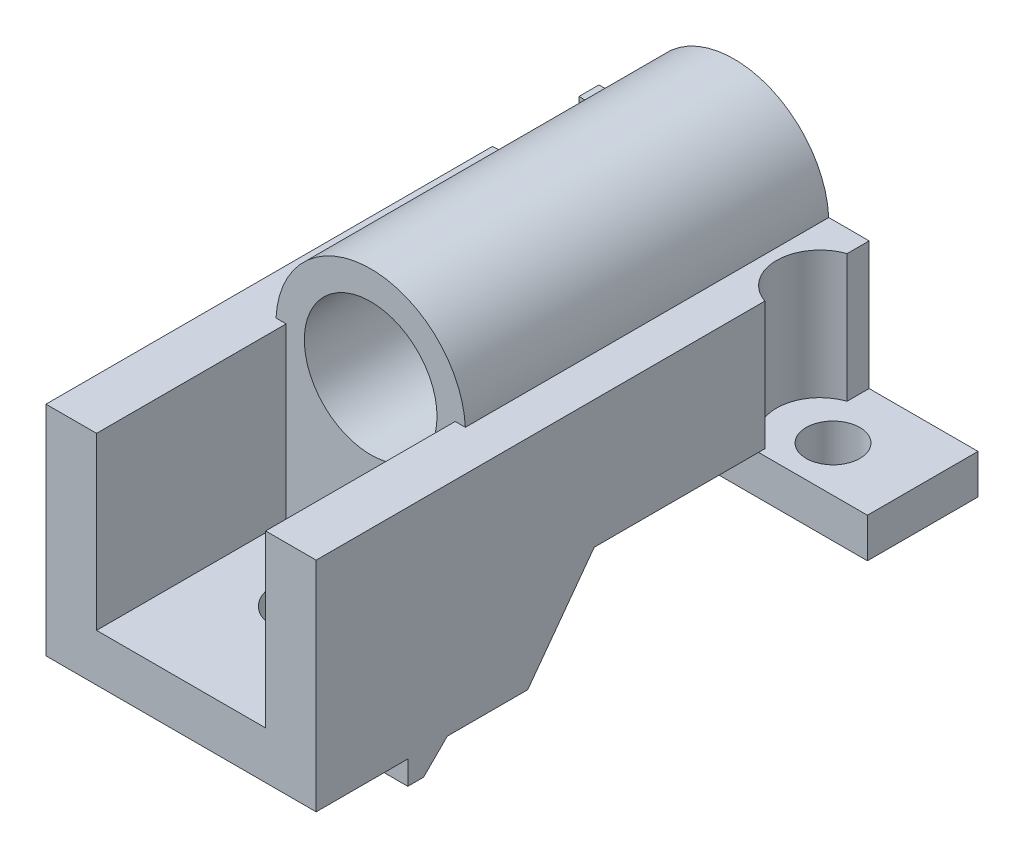
from build123d import *

# Parameters (mm, degrees)
BOSS_EXTRUDE1_DEPTH      = 8.55
SKETCH2_W                = 10.7
SKETCH2_H                = 10.8
CUT_EXTRUDE1_DEPTH       = 12
SKETCH3_R                = 6
BOSS_EXTRUDE2_DEPTH      = 23
SKETCH4_R                = 4.2
CUT_EXTRUDE2_DEPTH       = 29.152131358
BOSS_EXTRUDE5_DEPTH      = 17.1
CUT_EXTRUDE4_REACH       = 36.056
SKETCH10_W               = 8.1
SKETCH10_H               = 1.5
SKETCH7_R                = 2.2
CUT_EXTRUDE3_DEPTH       = 40.626944786
CUT_EXTRUDE9_START       = -22
CUT_EXTRUDE9_DEPTH       = 22
BOSS_EXTRUDE6_DEPTH      = 1.553
SKETCH16_W               = 28
SKETCH16_H               = 2.5
BOSS_EXTRUDE8_DEPTH      = 7
CUT_EXTRUDE8_DEPTH       = 6.997
CUT_EXTRUDE10_REACH      = 42.722
SKETCH19_R               = 2.83394
CUT_EXTRUDE11_DEPTH      = 41.664727171
CUT_EXTRUDE11_DEPTH_BACK = 41.664727171
SKETCH20_R               = 1.7
SKETCH21_R               = 2.75
CUT_EXTRUDE12_DEPTH      = 41.664727171
CUT_EXTRUDE13_REACH      = 47.107


with BuildPart() as part:
    # Sketch1 → Boss-Extrude1 (new, symmetric)
    with BuildSketch(Plane(origin=(0, 0, 0), x_dir=(0, 0, -1), z_dir=(1, 0, 0))):
        Polygon((0, 0), (0, -8.09401), (-21.6094, -13.8), (-35, -13.8), (-35, 0), align=None)
    extrude(amount=BOSS_EXTRUDE1_DEPTH, both=True)

    # Sketch2 → Cut-Extrude1 (cut)
    with BuildSketch(Plane.XY.offset(35)):
        with Locations((0, -5.4)):
            Rectangle(SKETCH2_W, SKETCH2_H)
    extrude(amount=-CUT_EXTRUDE1_DEPTH, mode=Mode.SUBTRACT)

    # Sketch3 → Boss-Extrude2 (add, through all)
    with BuildSketch(Plane.XY.offset(23)):
        with Locations((0, -0.30175)):
            Circle(SKETCH3_R)
    extrude(amount=-BOSS_EXTRUDE2_DEPTH)

    # Sketch4 → Cut-Extrude2 (cut, through all)
    with BuildSketch(Plane.XY.offset(23)):
        with Locations((0, -0.30175)):
            Circle(SKETCH4_R)
    extrude(amount=-CUT_EXTRUDE2_DEPTH, mode=Mode.SUBTRACT)

    # Sketch8 → Boss-Extrude5 (add, through all)
    with BuildSketch(Plane(origin=(8.55, 0, 0), x_dir=(0, 0, -1), z_dir=(1, 0, 0))):
        Polygon((-29.2, -13.8), (-29.2, -15.3), (-28.2, -15.3), (-26.7, -13.8), align=None)
    extrude(amount=-BOSS_EXTRUDE5_DEPTH)

    # Cut-Extrude4: up to this plane
    cut_extrude4_end = Plane(origin=(-8.55, -15.3, 28.2), z_dir=(0, -0.7071067811865467, -0.7071067811865483))
    # Sketch10 → Cut-Extrude4 (cut, up to the surface)
    with BuildSketch(Plane.XY.offset(29.2), mode=Mode.PRIVATE) as cut_extrude4_sk1:
        with Locations((0, -14.55)):
            Rectangle(SKETCH10_W, SKETCH10_H)
    cut_extrude4_tool1 = split(extrude(cut_extrude4_sk1.sketch, amount=-CUT_EXTRUDE4_REACH, mode=Mode.PRIVATE), bisect_by=cut_extrude4_end, keep=Keep.BOTH, mode=Mode.PRIVATE)
    add(cut_extrude4_tool1.solids().sort_by_distance((0, -14.55, 29.2))[0], mode=Mode.SUBTRACT)

    # Sketch7 → Cut-Extrude3 (cut, through all)
    with BuildSketch(Plane(origin=(0, -10.8, 0), x_dir=(1, 0, 0), z_dir=(0, 1, 0))):
        with Locations(Location((0, -27, 0), (0, 0, 180))):
            Circle(SKETCH7_R)
    extrude(amount=-CUT_EXTRUDE3_DEPTH, mode=Mode.SUBTRACT)

    # Sketch18 → Cut-Extrude9 (cut)
    with BuildSketch(Plane(origin=(0, 0, 0), x_dir=(-1, 0, 0), z_dir=(0, 0, -1)).offset(CUT_EXTRUDE9_START)):
        with BuildLine():
            Line((-5.35, -3.017905371), (-5.35, -13.8))
            Line((-5.35, -13.8), (5.35, -13.8))
            Line((5.35, -13.8), (5.35, -3.017905371))
            ThreePointArc((5.35, -3.017905371), (0, -6.30175), (-5.35, -3.017905371))
        make_face()
    extrude(amount=CUT_EXTRUDE9_DEPTH, mode=Mode.SUBTRACT)

    # Sketch14 → Boss-Extrude6 (add, symmetric)
    with BuildSketch(Plane(origin=(0, 0, 0), x_dir=(0, 0, -1), z_dir=(1, 0, 0))):
        Polygon((-20, -13.8), (-17.001986023, -10.59401), (0, -10.59401), (0, -4.8), (-22, -4.8), (-22, -13.8), align=None)
    extrude(amount=BOSS_EXTRUDE6_DEPTH, both=True)

    # Sketch16 → Boss-Extrude8 (add)
    with BuildSketch(Plane(origin=(0, 0, 0), x_dir=(-1, 0, 0), z_dir=(0, 0, -1))):
        with Locations((-1.44, -9.34401)):
            Rectangle(SKETCH16_W, SKETCH16_H)
    extrude(amount=-BOSS_EXTRUDE8_DEPTH)

    # Sketch17 → Cut-Extrude8 (cut)
    with BuildSketch(Plane(origin=(8.55, 0, 0), x_dir=(0, 0, -1), z_dir=(1, 0, 0))):
        Polygon((-7, -8.09401), (-17.4, -8.09401), (-21.6094, -13.8), (-7, -13.8), align=None)
    extrude(amount=-CUT_EXTRUDE8_DEPTH, mode=Mode.SUBTRACT)

    # Sketch19 → Cut-Extrude10 (cut, up to next)
    with BuildSketch(Plane(origin=(1.553, 0, 0), x_dir=(0, 0, -1), z_dir=(1, 0, 0)), mode=Mode.PRIVATE) as cut_extrude10_sk1:
        with Locations((-9.50021991, -11.92822)):
            Circle(SKETCH19_R)
    cut_extrude10_tool1 = extrude(cut_extrude10_sk1.sketch, amount=-CUT_EXTRUDE10_REACH, mode=Mode.PRIVATE) & part.part
    add(cut_extrude10_tool1.solids().sort_by_distance((1.553, -11.92822, 9.50022))[0], mode=Mode.SUBTRACT)

    # Sketch20 → Cut-Extrude11 (cut, two sides: drawn at the far end of the back side and taken through both)
    with BuildSketch(Plane(origin=(0, -8.09401, 0), x_dir=(1, 0, 0), z_dir=(0, 1, 0)).offset(-CUT_EXTRUDE11_DEPTH_BACK)):
        with Locations(Location((-9.06279, -4.126, 0), (0, 0, 270))):
            Circle(SKETCH20_R)
        with Locations(Location((10.39013, -4.126, 0), (0, 0, 270))):
            Circle(SKETCH20_R)
    extrude(amount=CUT_EXTRUDE11_DEPTH + CUT_EXTRUDE11_DEPTH_BACK, mode=Mode.SUBTRACT)

    # Sketch21 → Cut-Extrude12 (cut, through all)
    with BuildSketch(Plane(origin=(0, -8.09401, 0), x_dir=(1, 0, 0), z_dir=(0, 1, 0))):
        with Locations((-8.56, -4)):
            Circle(SKETCH21_R)
        with Locations((9.44, -4)):
            Circle(SKETCH21_R)
    extrude(amount=CUT_EXTRUDE12_DEPTH, mode=Mode.SUBTRACT)

    # Sketch22 → Cut-Extrude13 (cut, up to next)
    with BuildSketch(Plane.ZY.offset(8.55), mode=Mode.PRIVATE) as cut_extrude13_sk1:
        Polygon((17.4, -8.09401), (7, -8.09401), (7, -9.942369047), (21.6094, -13.8), align=None)
    cut_extrude13_tool1 = extrude(cut_extrude13_sk1.sketch, amount=-CUT_EXTRUDE13_REACH, mode=Mode.PRIVATE) & part.part
    add(cut_extrude13_tool1.solids().sort_by_distance((-8.55, -10.188689, 14.252315))[0], mode=Mode.SUBTRACT)


solid = part.part
